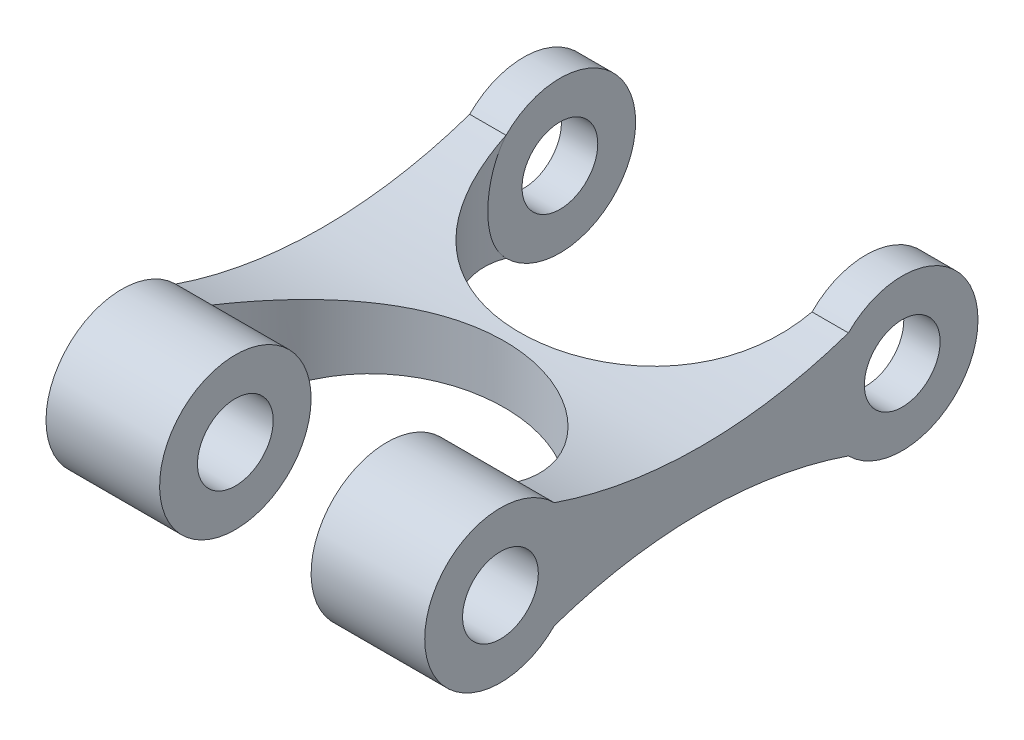
from build123d import *

# Parameters (mm, degrees)
SKETCH2_R               = 2.5
SKETCH2_R_2             = 1.25
BOSS_EXTRUDE1_DEPTH     = 6.25
BOSS_EXTRUDE1_2_DEPTH   = 6.25
SKETCH3_R               = 2.5
SKETCH3_R_2             = 1.25
CUT_EXTRUDE1_DEPTH      = 5.05
BOSS_EXTRUDE2_DEPTH     = 6.25
CUT_EXTRUDE2_DEPTH      = 12.34392559
CUT_EXTRUDE2_DEPTH_BACK = 12.34392559
SKETCH6_R               = 1.25
BOSS_EXTRUDE3_DEPTH     = 11.001
SKETCH7_R               = 2.5
SKETCH7_R_2             = 1.25
CUT_EXTRUDE3_DEPTH      = 2.5
SCALE1_SCALE            = 1.5


with BuildPart() as part:
    # Sketch2 → Boss-Extrude1 (new, symmetric)
    with BuildSketch(Plane(origin=(0, 0, 0), x_dir=(0, 0, -1), z_dir=(1, 0, 0))):
        with Locations((6.630835, 0)):
            Circle(SKETCH2_R)
        with Locations((6.630835, 0)):
            Circle(SKETCH2_R_2, mode=Mode.SUBTRACT)
    extrude(amount=BOSS_EXTRUDE1_DEPTH, both=True)


with BuildPart() as body_2:
    # Sketch2 → Boss-Extrude1 2 (new, symmetric)
    with BuildSketch(Plane(origin=(0, 0, 0), x_dir=(0, 0, -1), z_dir=(1, 0, 0))):
        with Locations((-6.630835, 0)):
            Circle(SKETCH2_R)
        with Locations((-6.630835, 0)):
            Circle(SKETCH2_R_2, mode=Mode.SUBTRACT)
    extrude(amount=BOSS_EXTRUDE1_2_DEPTH, both=True)


with BuildPart() as cut_extrude1_tool:
    # Sketch3 → Cut-Extrude1 (new, symmetric)
    # profile 1 of 2: a face of its own
    with BuildSketch(Plane(origin=(0, 0, 0), x_dir=(0, 0, -1), z_dir=(1, 0, 0))):
        with Locations((6.630835, 0)):
            Circle(SKETCH3_R)
        with Locations((6.630835, 0)):
            Circle(SKETCH3_R_2, mode=Mode.SUBTRACT)
    # profile 2 of 2: a face of its own
    with BuildSketch(Plane(origin=(0, 0, 0), x_dir=(0, 0, -1), z_dir=(1, 0, 0))):
        with Locations((-6.630835, 0)):
            Circle(SKETCH3_R)
        with Locations((-6.630835, 0)):
            Circle(SKETCH3_R_2, mode=Mode.SUBTRACT)
    extrude(amount=CUT_EXTRUDE1_DEPTH, both=True)


with BuildPart() as part_1:
    add(part.part)

    # Cut-Extrude1: cut by cut_extrude1_tool
    add(cut_extrude1_tool.part, mode=Mode.SUBTRACT)


with BuildPart() as body_2_1:
    add(body_2.part)

    # Cut-Extrude1: cut by cut_extrude1_tool
    add(cut_extrude1_tool.part, mode=Mode.SUBTRACT)


with BuildPart() as cut_extrude1_piece_1:
    # of the separate pieces the step leaves, piece 1, a body of its own (cut_extrude1_pieces)
    add(part_1.part.solids().sort_by_distance((-6.25, 0, -9.130835))[0])



with BuildPart() as cut_extrude1_piece_2:
    # of the separate pieces the step leaves, piece 2, a body of its own (cut_extrude1_pieces)
    add(part_1.part.solids().sort_by_distance((5.05, 0, -9.130835))[0])


with BuildPart() as cut_extrude1_piece_1_of_body_2:
    # of the separate pieces the step leaves, piece 1, a body of its own (cut_extrude1_pieces_of_body_2)
    add(body_2_1.part.solids().sort_by_distance((-6.25, 0, 4.130835))[0])


with BuildPart() as cut_extrude1_piece_2_of_body_2:
    # of the separate pieces the step leaves, piece 2, a body of its own (cut_extrude1_pieces_of_body_2)
    add(body_2_1.part.solids().sort_by_distance((5.05, 0, 4.130835))[0])


with BuildPart() as cut_extrude1_piece_1_1:
    add(cut_extrude1_piece_1.part)

    add(cut_extrude1_piece_2.part)  # Boss-Extrude2 merges Cut-Extrude1 piece 2

    add(cut_extrude1_piece_1_of_body_2.part)  # Boss-Extrude2 merges Cut-Extrude1 piece 1 of body 2

    add(cut_extrude1_piece_2_of_body_2.part)  # Boss-Extrude2 merges Cut-Extrude1 piece 2 of body 2
    # Sketch4 → Boss-Extrude2 (add, symmetric)
    with BuildSketch(Plane(origin=(0, 0, 0), x_dir=(0, 0, -1), z_dir=(1, 0, 0))):
        with BuildLine():
            ThreePointArc((4.853650324, 1.758298788), (4.130835, 0), (4.853650324, -1.758298788))
            ThreePointArc((4.853650324, -1.758298788), (0, -0.947912117), (-4.853650324, -1.758298788))
            ThreePointArc((-4.853650324, -1.758298788), (-4.130835, 0), (-4.853650324, 1.758298788))
            ThreePointArc((-4.853650324, 1.758298788), (0, 0.947912117), (4.853650324, 1.758298788))
        make_face()
    extrude(amount=BOSS_EXTRUDE2_DEPTH, both=True)

    # Sketch5 → Cut-Extrude2 (cut, two sides: drawn at the far end of the back side and taken through both)
    with BuildSketch(Plane(origin=(0, 0, 0), x_dir=(1, 0, 0), z_dir=(0, 1, 0)).offset(-CUT_EXTRUDE2_DEPTH_BACK)):
        with BuildLine():
            Line((-5.05, 4.853650324), (5.05, 4.853650324))
            ThreePointArc((5.05, 4.853650324), (0, 0.25), (-5.05, 4.853650324))
        make_face()
        with BuildLine():
            Line((5.05, -4.853650324), (-5.05, -4.853650324))
            ThreePointArc((-5.05, -4.853650324), (0, -0.25), (5.05, -4.853650324))
        make_face()
    extrude(amount=CUT_EXTRUDE2_DEPTH + CUT_EXTRUDE2_DEPTH_BACK, mode=Mode.SUBTRACT)

    # Sketch6 → Boss-Extrude3 (add)
    with BuildSketch(Plane(origin=(-5.05, 0, 0), x_dir=(0, 0, -1), z_dir=(1, 0, 0))):
        with BuildLine():
            ThreePointArc((-4.853650324, 1.758298788), (-9.130835, 0), (-4.853650324, -1.758298788))
            ThreePointArc((-4.853650324, -1.758298788), (-4.130835, 0), (-4.853650324, 1.758298788))
        make_face()
        with Locations((-6.630835, 0)):
            Circle(SKETCH6_R, mode=Mode.SUBTRACT)
    extrude(amount=BOSS_EXTRUDE3_DEPTH)

    # Sketch7 → Cut-Extrude3 (cut, symmetric)
    with BuildSketch(Plane(origin=(0, 0, 0), x_dir=(0, 0, -1), z_dir=(1, 0, 0))):
        with Locations(Location((-6.630835, 0, 0), (0, 0, 44.693939637))):
            Circle(SKETCH7_R)
        with Locations((-6.630835, 0)):
            Circle(SKETCH7_R_2, mode=Mode.SUBTRACT)
    extrude(amount=CUT_EXTRUDE3_DEPTH, both=True, mode=Mode.SUBTRACT)


with BuildPart() as cut_extrude1_piece_1_2:
    # Scale1: scaled about (-1.5e-08, -4.9e-08, 2.005345841)
    add(cut_extrude1_piece_1_1.part.scale(SCALE1_SCALE).moved(Location((7e-09, 2.5e-08, -1.002672921))))


solid = cut_extrude1_piece_1_2.part
